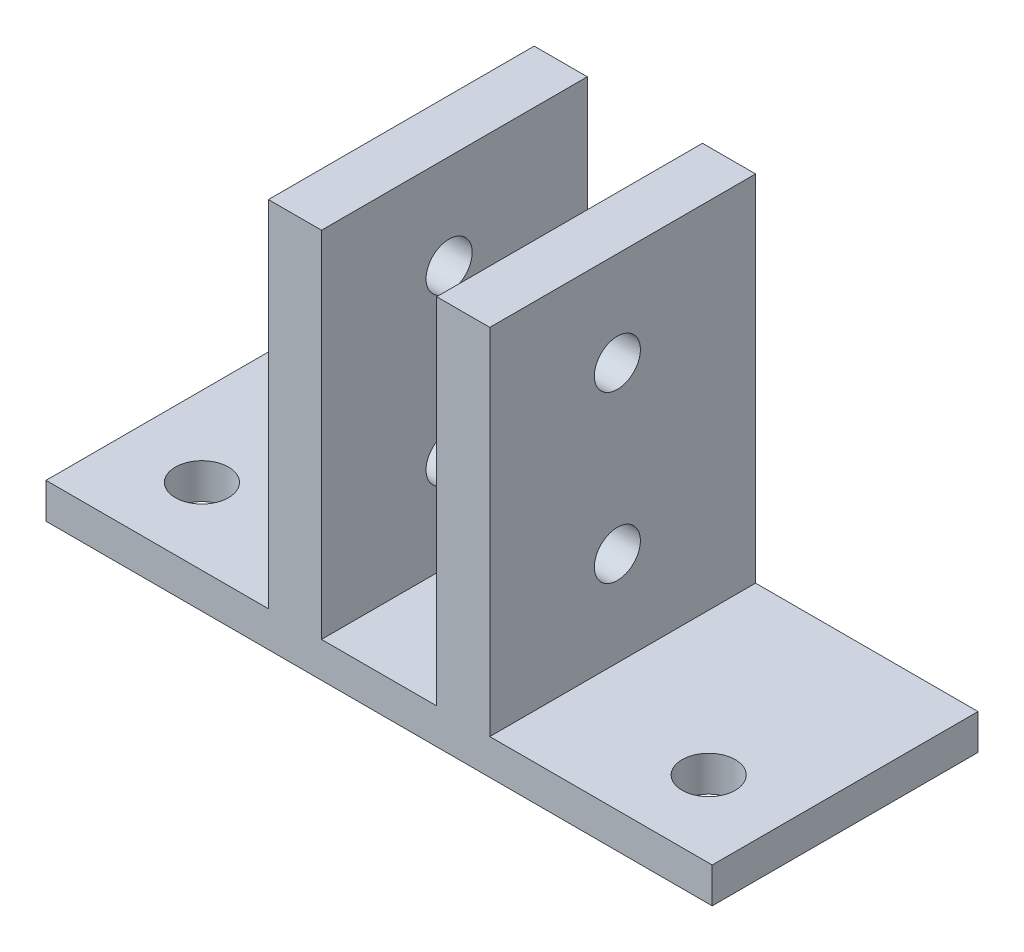
from build123d import *

# Parameters (mm, degrees)
CROQUIS1_W              = 37.6
CROQUIS1_H              = 15
CROQUIS1_R              = 1.5
SALIENTE_EXTRUIR1_DEPTH = 2
CROQUIS2_W              = 2.997393123
CROQUIS2_H              = 15
SALIENTE_EXTRUIR2_DEPTH = 20
CROQUIS3_R              = 1.3
CORTAR_EXTRUIR1_DEPTH   = 20


with BuildPart() as part:
    # Croquis1 → Saliente-Extruir1 (new body)
    with BuildSketch(Plane(origin=(0, 0, 0), x_dir=(1, 0, 0), z_dir=(0, 1, 0))):
        Rectangle(CROQUIS1_W, CROQUIS1_H)
        with Locations(Location((14.3, -3.2, 0), (0, 0, 270))):
            Circle(CROQUIS1_R, mode=Mode.SUBTRACT)
        with Locations(Location((-14.3, -3.2, 0), (0, 0, 90))):
            Circle(CROQUIS1_R, mode=Mode.SUBTRACT)
    extrude(amount=SALIENTE_EXTRUIR1_DEPTH)

    # Croquis2 → Saliente-Extruir2 (add)
    with BuildSketch(Plane(origin=(0, 2, 0), x_dir=(1, 0, 0), z_dir=(0, 1, 0))):
        with Locations((-4.748696562, 0)):
            Rectangle(CROQUIS2_W, CROQUIS2_H)
        with Locations((4.748696562, 0)):
            Rectangle(CROQUIS2_W, CROQUIS2_H)
    extrude(amount=SALIENTE_EXTRUIR2_DEPTH)

    # Croquis3 → Cortar-Extruir1 (cut)
    with BuildSketch(Plane.ZY.offset(6.247393123)):
        with Locations((0.3, 16.669676255)):
            Circle(CROQUIS3_R)
        with Locations((0.3, 7.330323745)):
            Circle(CROQUIS3_R)
    extrude(amount=-CORTAR_EXTRUIR1_DEPTH, mode=Mode.SUBTRACT)


solid = part.part
